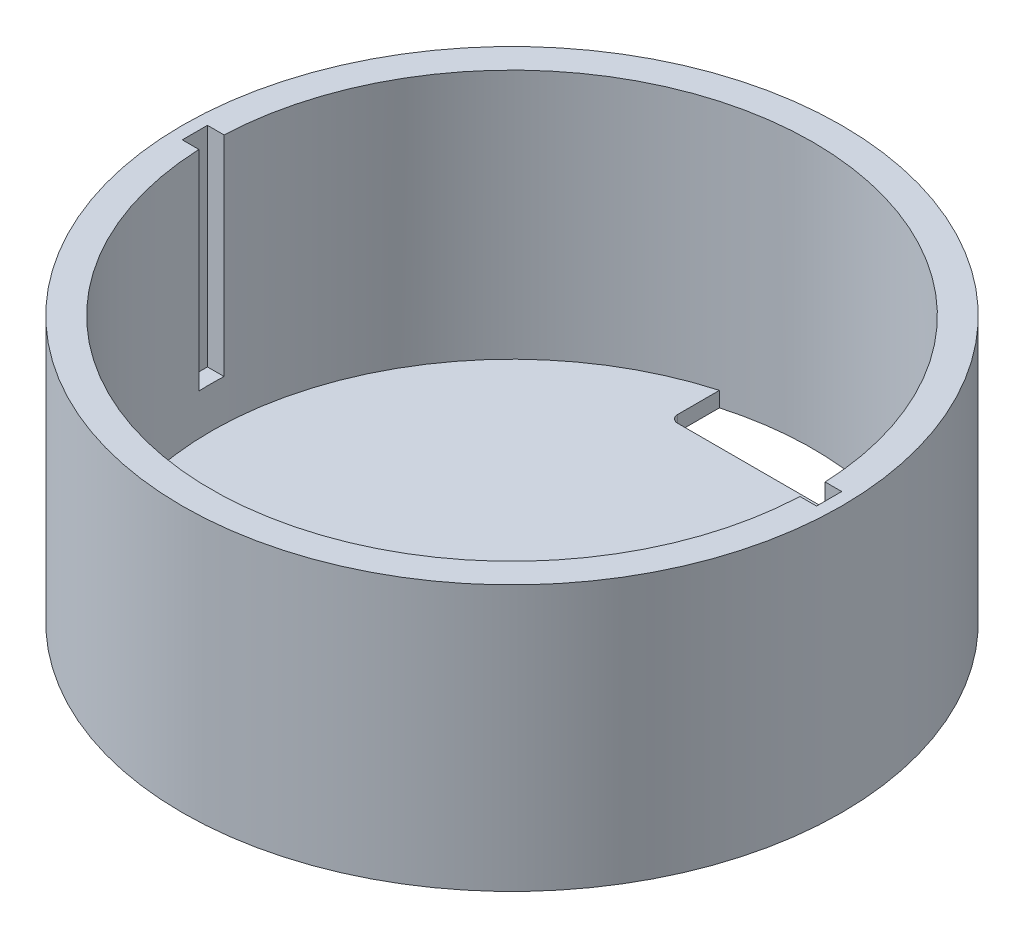
from build123d import *

# Parameters (mm, degrees)
SKETCH1_R            = 43.456311094
BOSS_EXTRUDE10_DEPTH = 35
BOSS_EXTRUDE18_DEPTH = 7.421557236
SKETCH1_18_R         = 4.75
BOSS_EXTRUDE19_DEPTH = 2


with BuildPart() as part:
    # Sketch1 → Boss-Extrude10 (new body)
    with BuildSketch(Plane(origin=(0, 0, 0), x_dir=(1, 0, 0), z_dir=(0, 1, 0))):
        Circle(SKETCH1_R)
        with BuildLine():
            ThreePointArc((-10.807631289, 38.145414948), (0.461333582, 39.644227158), (11.692368711, 37.883586018))
            ThreePointArc((11.692368711, 37.883586018), (31.402087475, 24.203026213), (39.612178769, 1.659177136))
            Line((39.612178769, 1.659177136), (41.800929267, 1.659177136))
            Line((41.800929267, 1.659177136), (41.800929267, -1.659177136))
            Line((41.800929267, -1.659177136), (39.612178769, -1.659177136))
            ThreePointArc((39.612178769, -1.659177136), (0, -39.6469113), (-39.612178769, -1.659177136))
            Line((-39.612178769, -1.659177136), (-41.800929267, -1.659177136))
            Line((-41.800929267, -1.659177136), (-41.800929267, 1.659177136))
            Line((-41.800929267, 1.659177136), (-39.612178769, 1.659177136))
            ThreePointArc((-39.612178769, 1.659177136), (-31.118333808, 24.566784011), (-10.807631289, 38.145414948))
        make_face(mode=Mode.SUBTRACT)
    extrude(amount=BOSS_EXTRUDE10_DEPTH)

    # Sketch1<17> → Boss-Extrude18 (add)
    with BuildSketch(Plane(origin=(0, 0, 0), x_dir=(1, 0, 0), z_dir=(0, 1, 0))):
        with BuildLine():
            Line((41.800929267, 1.659177136), (39.612178769, 1.659177136))
            ThreePointArc((39.612178769, 1.659177136), (39.6469113, 0), (39.612178769, -1.659177136))
            Line((39.612178769, -1.659177136), (41.800929267, -1.659177136))
            Line((41.800929267, -1.659177136), (41.800929267, 1.659177136))
        make_face()
        with BuildLine():
            ThreePointArc((-39.612178769, -1.659177136), (-39.6469113, 0), (-39.612178769, 1.659177136))
            Line((-39.612178769, 1.659177136), (-41.800929267, 1.659177136))
            Line((-41.800929267, 1.659177136), (-41.800929267, -1.659177136))
            Line((-41.800929267, -1.659177136), (-39.612178769, -1.659177136))
        make_face()
    extrude(amount=BOSS_EXTRUDE18_DEPTH)

    # Sketch1<18> → Boss-Extrude19 (add)
    with BuildSketch(Plane(origin=(0, 0, 0), x_dir=(1, 0, 0), z_dir=(0, 1, 0))):
        with BuildLine():
            Line((11.692368711, 37.883586018), (11.692368711, 32.635924628))
            ThreePointArc((11.692368711, 32.635924628), (11.399475492, 31.928817847), (10.692368711, 31.635924628))
            Line((10.692368711, 31.635924628), (-9.807631289, 31.635924628))
            ThreePointArc((-9.807631289, 31.635924628), (-10.51473807, 31.928817847), (-10.807631289, 32.635924628))
            Line((-10.807631289, 32.635924628), (-10.807631289, 38.145414948))
            ThreePointArc((-10.807631289, 38.145414948), (-0.461333582, -39.644227158), (11.692368711, 37.883586018))
        make_face()
        Circle(SKETCH1_18_R, mode=Mode.SUBTRACT)
    extrude(amount=BOSS_EXTRUDE19_DEPTH)


solid = part.part
